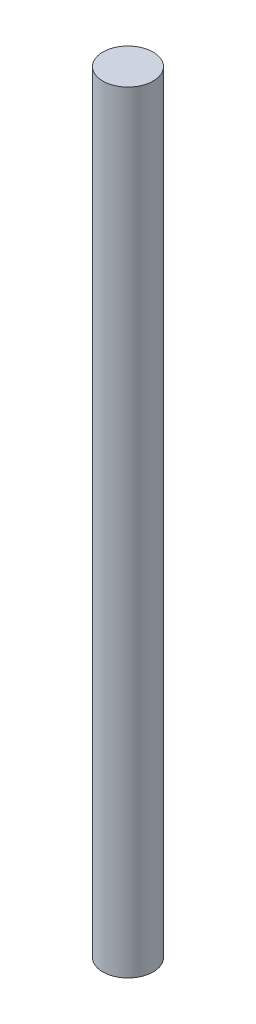
from build123d import *

# Parameters (mm, degrees)
SKETCH_1_R      = 1.5
EXTRUDE_1_DEPTH = 46


with BuildPart() as part:
    # 草图1 → 凸台-拉伸1 (new body)
    with BuildSketch(Plane(origin=(0, 0, 0), x_dir=(1, 0, 0), z_dir=(0, 1, 0))):
        with Locations(Location((0, 0, 0), (0, 0, 270))):
            Circle(SKETCH_1_R)
    extrude(amount=EXTRUDE_1_DEPTH)


solid = part.part
